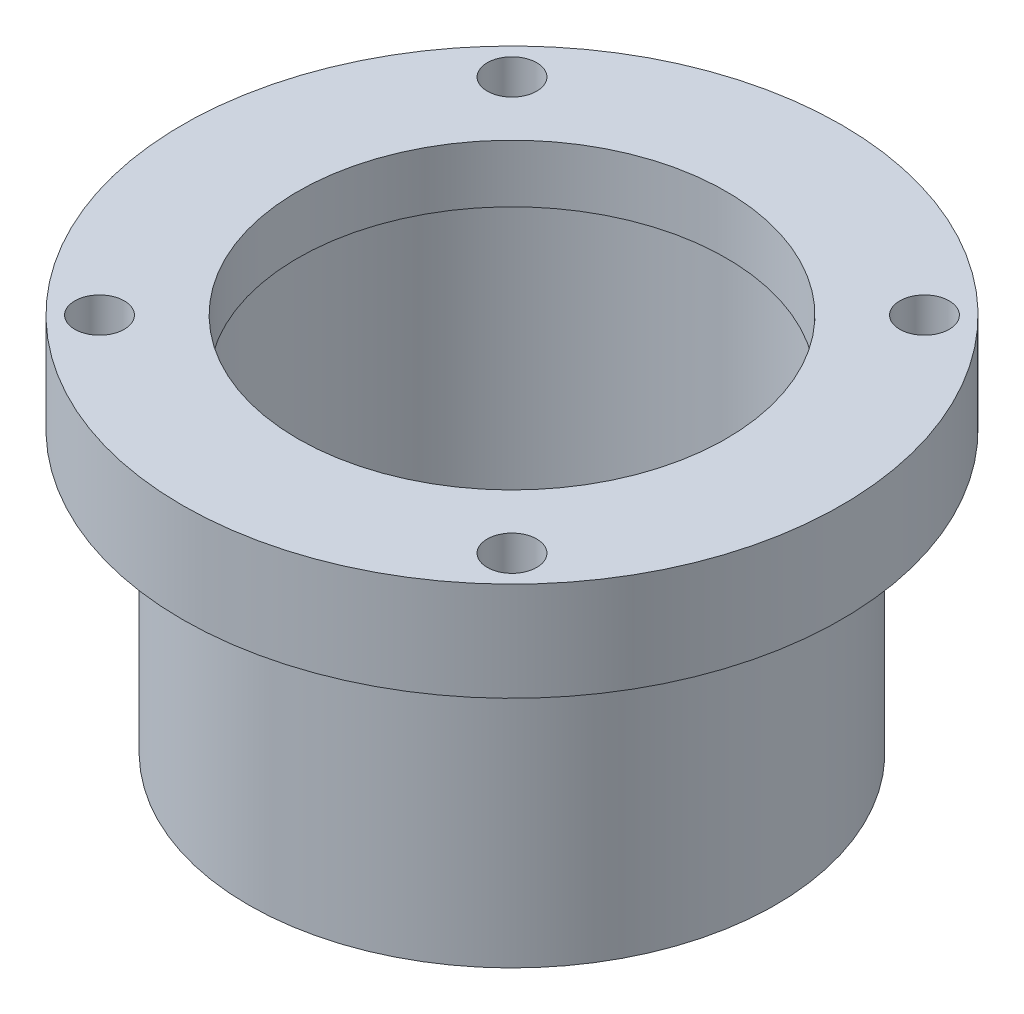
from build123d import *

# Parameters (mm, degrees)
CARTRIDGE_BARREL_SKETCH_R         = 16
CARTRIDGE_BARREL_DEPTH            = 17
SIX_MILLIMETRE_FLANGE_SKETCH_R    = 20
SIX_MILLIMETRE_FLANGE_DEPTH       = 6
BEARING_BORE_SKETCH_R             = 14
BEARING_BORE_DEPTH                = 19.6
OUTER_RACE_SHOULDER_EXIT_SKETCH_R = 13
OUTER_RACE_SHOULDER_EXIT_DEPTH    = 3.6
M3_TAPPED_HOLE_PATTERN_SKETCH_R   = 1.5
M3_TAPPED_HOLE_PATTERN_DEPTH      = 6.2


with BuildPart() as part:
    # Cartridge barrel sketch → Cartridge barrel (new body)
    with BuildSketch(Plane(origin=(0, -237.5, 0), x_dir=(1, 0, 0), z_dir=(0, 1, 0))):
        with Locations(Location((-19.009182883, 53.244882879, 0), (0, 0, 270))):
            Circle(CARTRIDGE_BARREL_SKETCH_R)
    extrude(amount=CARTRIDGE_BARREL_DEPTH)

    # Six millimetre flange sketch → Six millimetre flange (add)
    with BuildSketch(Plane(origin=(0, -220.5, 0), x_dir=(1, 0, 0), z_dir=(0, 1, 0))):
        with Locations(Location((-19.009182883, 53.244882879, 0), (0, 0, 270))):
            Circle(SIX_MILLIMETRE_FLANGE_SKETCH_R)
    extrude(amount=SIX_MILLIMETRE_FLANGE_DEPTH)

    # Bearing bore sketch → Bearing bore (cut)
    with BuildSketch(Plane(origin=(0, -237.6, 0), x_dir=(1, 0, 0), z_dir=(0, 1, 0))):
        with Locations(Location((-19.009182883, 53.244882879, 0), (0, 0, 270))):
            Circle(BEARING_BORE_SKETCH_R)
    extrude(amount=BEARING_BORE_DEPTH, mode=Mode.SUBTRACT)

    # Outer race shoulder exit sketch → Outer race shoulder exit (cut)
    with BuildSketch(Plane(origin=(0, -218, 0), x_dir=(1, 0, 0), z_dir=(0, 1, 0))):
        with Locations(Location((-19.009182883, 53.244882879, 0), (0, 0, 270))):
            Circle(OUTER_RACE_SHOULDER_EXIT_SKETCH_R)
    extrude(amount=OUTER_RACE_SHOULDER_EXIT_DEPTH, mode=Mode.SUBTRACT)

    # M3 tapped hole pattern sketch → M3 tapped hole pattern (cut)
    with BuildSketch(Plane(origin=(0, -220.6, 0), x_dir=(1, 0, 0), z_dir=(0, 1, 0))):
        with Locations(Location((-6.493392856, 40.729092852, 0), (0, 0, 270))):
            Circle(M3_TAPPED_HOLE_PATTERN_SKETCH_R)
        with Locations(Location((-31.52497291, 40.729092852, 0), (0, 0, 270))):
            Circle(M3_TAPPED_HOLE_PATTERN_SKETCH_R)
        with Locations(Location((-31.52497291, 65.760672906, 0), (0, 0, 270))):
            Circle(M3_TAPPED_HOLE_PATTERN_SKETCH_R)
        with Locations(Location((-6.493392856, 65.760672906, 0), (0, 0, 270))):
            Circle(M3_TAPPED_HOLE_PATTERN_SKETCH_R)
    extrude(amount=M3_TAPPED_HOLE_PATTERN_DEPTH, mode=Mode.SUBTRACT)


solid = part.part
